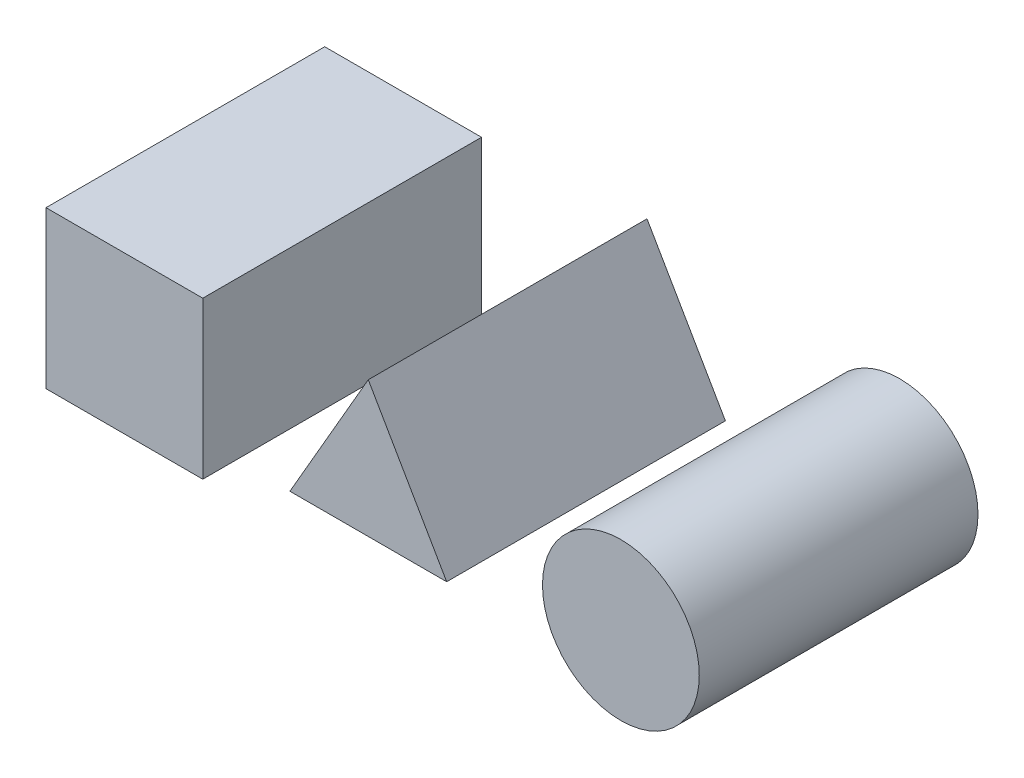
from build123d import *

# Parameters (mm, degrees)
SKETCH1_R             = 22.5
BOSS_EXTRUDE1_DEPTH   = 80
BOSS_EXTRUDE1_2_DEPTH = 80
SKETCH1_W             = 45
SKETCH1_H             = 45
BOSS_EXTRUDE1_3_DEPTH = 80


with BuildPart() as part:
    # Sketch1 → Boss-Extrude1 (new body)
    with BuildSketch(Plane.XY):
        with Locations((72.5, 0)):
            Circle(SKETCH1_R)
    extrude(amount=BOSS_EXTRUDE1_DEPTH)


with BuildPart() as body_2:
    # Sketch1 → Boss-Extrude1 2 (new body)
    with BuildSketch(Plane.XY):
        Polygon((-22.5, -12.990381057), (0, 25.980762114), (22.5, -12.990381057), align=None)
    extrude(amount=BOSS_EXTRUDE1_2_DEPTH)


with BuildPart() as body_3:
    # Sketch1 → Boss-Extrude1 3 (new body)
    with BuildSketch(Plane.XY):
        with Locations((-70, 0)):
            Rectangle(SKETCH1_W, SKETCH1_H)
    extrude(amount=BOSS_EXTRUDE1_3_DEPTH)


solid = Compound([part.part, body_2.part, body_3.part])
